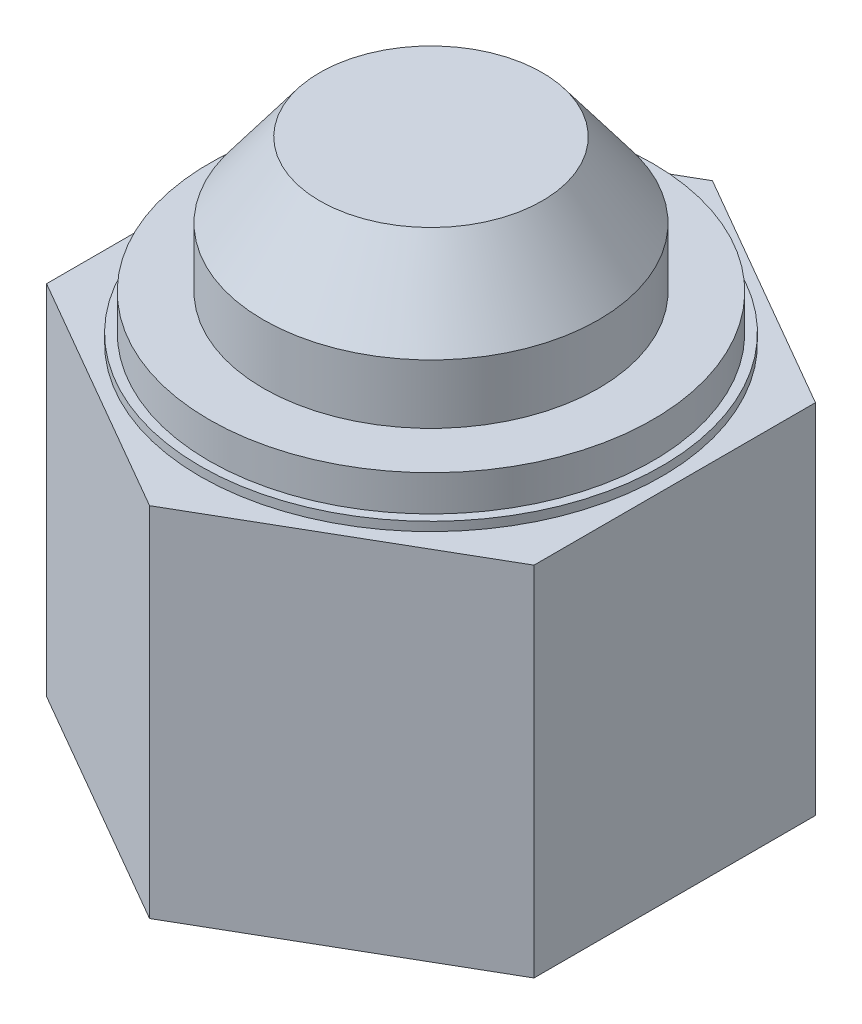
from build123d import *

# Parameters (mm, degrees)
SKETCH1_R           = 4.7625
BOSS_EXTRUDE1_DEPTH = 5.08
SKETCH1_4_R         = 6.35
BOSS_EXTRUDE4_DEPTH = 10.16
SKETCH7_R           = 6.304229739
BOSS_EXTRUDE5_DEPTH = 1.27
CHAMFER1_SIZE       = 2.126000066
CHAMFER1_SIZE2      = 1.60205596
SKETCH8_R           = 6.559510295
BOSS_EXTRUDE6_DEPTH = 0.254


with BuildPart() as part:
    # Sketch1 → Boss-Extrude1 (new body)
    with BuildSketch(Plane(origin=(0, 0, 0), x_dir=(1, 0, 0), z_dir=(0, 1, 0))):
        Circle(SKETCH1_R)
    extrude(amount=BOSS_EXTRUDE1_DEPTH)

    # Sketch7 → Boss-Extrude5 (add)
    with BuildSketch(Plane(origin=(0, 0, 0), x_dir=(1, 0, 0), z_dir=(0, 1, 0))):
        Circle(SKETCH7_R)
    extrude(amount=BOSS_EXTRUDE5_DEPTH)

    # Chamfer1
    chamfer1_edges = [part.edges().sort_by_distance(p)[0] for p in [
        (-4.7625, 5.08, 0),
    ]]
    chamfer1_side = [part.faces().sort_by_distance(p)[0] for p in [
        (-4.7625, 3.175, 0),
    ]]
    chamfer(chamfer1_edges, length=CHAMFER1_SIZE, length2=CHAMFER1_SIZE2, reference=chamfer1_side[0])



with BuildPart() as body_2:
    # Sketch1<4> → Boss-Extrude4 (new body)
    with BuildSketch(Plane(origin=(0, 0, 0), x_dir=(1, 0, 0), z_dir=(0, 1, 0))):
        Polygon((6.925488061, 3.998432396), (0, 7.996864793), (-6.925488061, 3.998432396), (-6.925488061, -3.998432396), (0, -7.996864793), (6.925488061, -3.998432396), align=None)
        Circle(SKETCH1_4_R, mode=Mode.SUBTRACT)
    extrude(amount=-BOSS_EXTRUDE4_DEPTH)


with BuildPart() as part_1:
    add(part.part)

    add(body_2.part)  # Boss-Extrude6 merges body 2
    # Sketch8 → Boss-Extrude6 (add)
    with BuildSketch(Plane(origin=(0, 0, 0), x_dir=(1, 0, 0), z_dir=(0, 1, 0))):
        Circle(SKETCH8_R)
    extrude(amount=BOSS_EXTRUDE6_DEPTH)


solid = part_1.part
